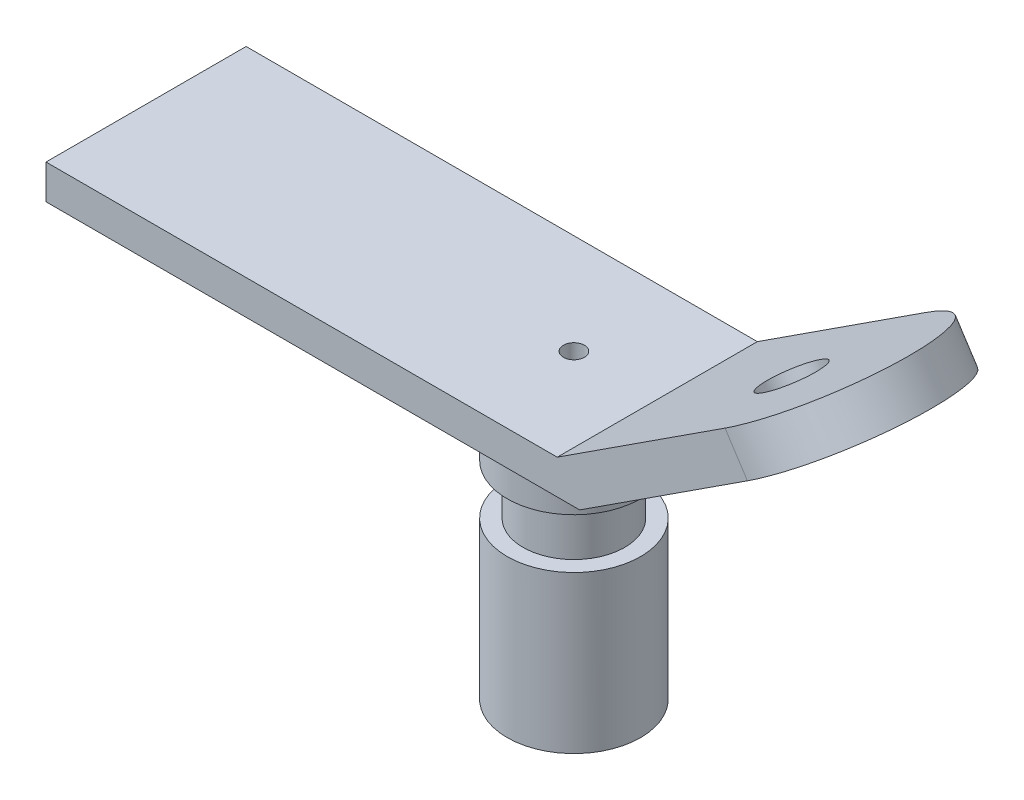
from build123d import *
from build123d.topology import SkipClean

# Parameters (mm, degrees)
BOSS_EXTRUDE1_DEPTH = 76.2
SKETCH2_R           = 25.4
SKETCH2_R_2         = 4.0005
BOSS_EXTRUDE2_DEPTH = 101.6
SKETCH4_W           = 6.35
SKETCH4_H           = 19.05
SKETCH5_R           = 4.0005
CUT_EXTRUDE1_DEPTH  = 240.623120754
SKETCH7_R           = 10.9982
CUT_EXTRUDE2_DEPTH  = 239.462040028
CUT_EXTRUDE3_DEPTH  = 239.462040028


with BuildPart() as part:
    # Sketch1 → Boss-Extrude1 (new body)
    with BuildSketch(Plane.XY):
        Polygon((-203.2, 13.126834176), (-8.532442214, 13.126834176), (0, 0), (-203.2, 0), align=None)
        Polygon((119.24636491, 96.183058807), (-8.532442214, 13.126834176), (0, 0), (127.778807124, 83.056224631), align=None)
    extrude(amount=BOSS_EXTRUDE1_DEPTH)

    # Sketch2 → Boss-Extrude2 (add)
    with BuildSketch(Plane.XZ):
        with Locations(Location((-40.282442214, 38.1, 0), (0, 0, 270))):
            Circle(SKETCH2_R)
        with Locations((-40.282442214, 38.1)):
            Circle(SKETCH2_R_2, mode=Mode.SUBTRACT)
    extrude(amount=BOSS_EXTRUDE2_DEPTH)

    # Sketch4 → Cut-Revolve1 (revolve, cut)
    with BuildSketch(Plane.XY.offset(38.1), mode=Mode.PRIVATE) as cut_revolve1_sk:
        with Locations((-62.817567444, -32.3596)):
            Rectangle(SKETCH4_W, SKETCH4_H)
    revolve(cut_revolve1_sk.sketch.rotate(Axis((-40.282442214, -101.6, 38.1), (0, 1, 0)), 270), axis=Axis((-40.282442214, -101.6, 38.1), (0, 1, 0)), mode=Mode.SUBTRACT)

    # Sketch5 → Cut-Extrude1 (cut, through all)
    with SkipClean():  # the faces are left unmerged after this step: merging them gives an invalid solid
        with BuildSketch(Plane.XZ):
            with Locations(Location((-40.282442214, 38.1, 0), (0, 0, 90))):
                Circle(SKETCH5_R)
        extrude(amount=-CUT_EXTRUDE1_DEPTH, mode=Mode.SUBTRACT)

    # Sketch7 → Cut-Extrude2 (cut, through all)
    with SkipClean():  # the faces are left unmerged after this step: merging them gives an invalid solid
        with BuildSketch(Plane(origin=(-8.532442214, 13.126834176, 0), x_dir=(0.8384436163006369, 0.5449883505954145, 0), z_dir=(-0.5449883505954145, 0.838443616300637, 0))):
            with Locations(Location((61.0108, -38.1, 0), (0, 0, 180))):
                Circle(SKETCH7_R)
        extrude(amount=-CUT_EXTRUDE2_DEPTH, mode=Mode.SUBTRACT)

    # Sketch8 → Cut-Extrude3 (cut, through all)
    with SkipClean():  # the faces are left unmerged after this step: merging them gives an invalid solid
        with BuildSketch(Plane(origin=(-8.532442214, 13.126834176, 0), x_dir=(0.8384436163006369, 0.5449883505954145, 0), z_dir=(-0.5449883505954145, 0.838443616300637, 0))):
            with BuildLine():
                Line((76.2, 0), (152.4, 0))
                Line((152.4, 0), (152.4, -76.2))
                Line((152.4, -76.2), (76.2, -76.2))
                ThreePointArc((76.2, -76.2), (114.3, -38.1), (76.2, 0))
            make_face()
        extrude(amount=-CUT_EXTRUDE3_DEPTH, mode=Mode.SUBTRACT)


solid = part.part
